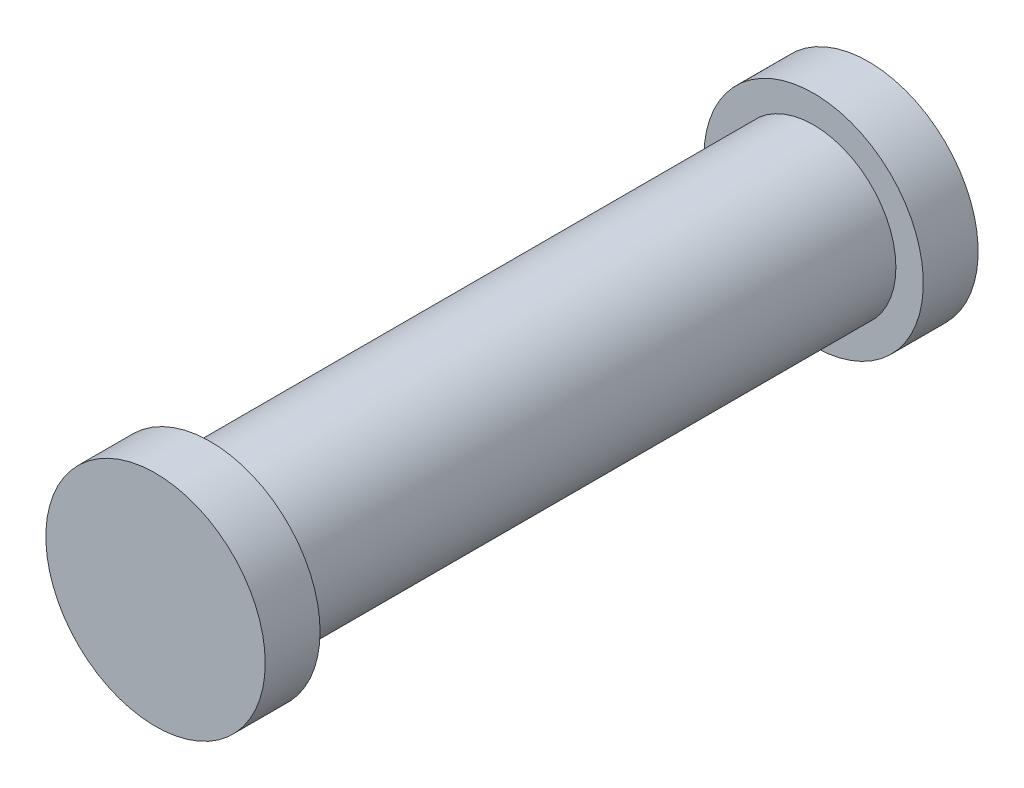
from build123d import *

# Parameters (mm, degrees)
SKETCH_1_R      = 30
EXTRUDE_1_DEPTH = 220
SKETCH_2_R      = 40
EXTRUDE_2_DEPTH = 20
EXTRUDE_START   = 20
SKETCH_3_R      = 40
EXTRUDE_3_DEPTH = 20
SCALE_1_SCALE   = 0.345


with BuildPart() as part:
    # 草图1 → 凸台-拉伸1 (new body)
    with BuildSketch(Plane.XY):
        Circle(SKETCH_1_R)
    extrude(amount=EXTRUDE_1_DEPTH)

    # 草图2 → 凸台-拉伸2 (add)
    with BuildSketch(Plane.XY.offset(220)):
        Circle(SKETCH_2_R)
    extrude(amount=EXTRUDE_2_DEPTH)

    # 草图3 → 凸台-拉伸3 (add)
    with BuildSketch(Plane(origin=(0, 0, 0), x_dir=(-1, 0, 0), z_dir=(0, 0, -1)).offset(EXTRUDE_START)):
        with Locations(Location((0, 0, 0), (0, 0, 180))):
            Circle(SKETCH_3_R)
    extrude(amount=-EXTRUDE_3_DEPTH)


with BuildPart() as part_1:
    # 缩放比例1: scaled about (0, 0, 0)
    add(part.part.scale(SCALE_1_SCALE))


solid = part_1.part
